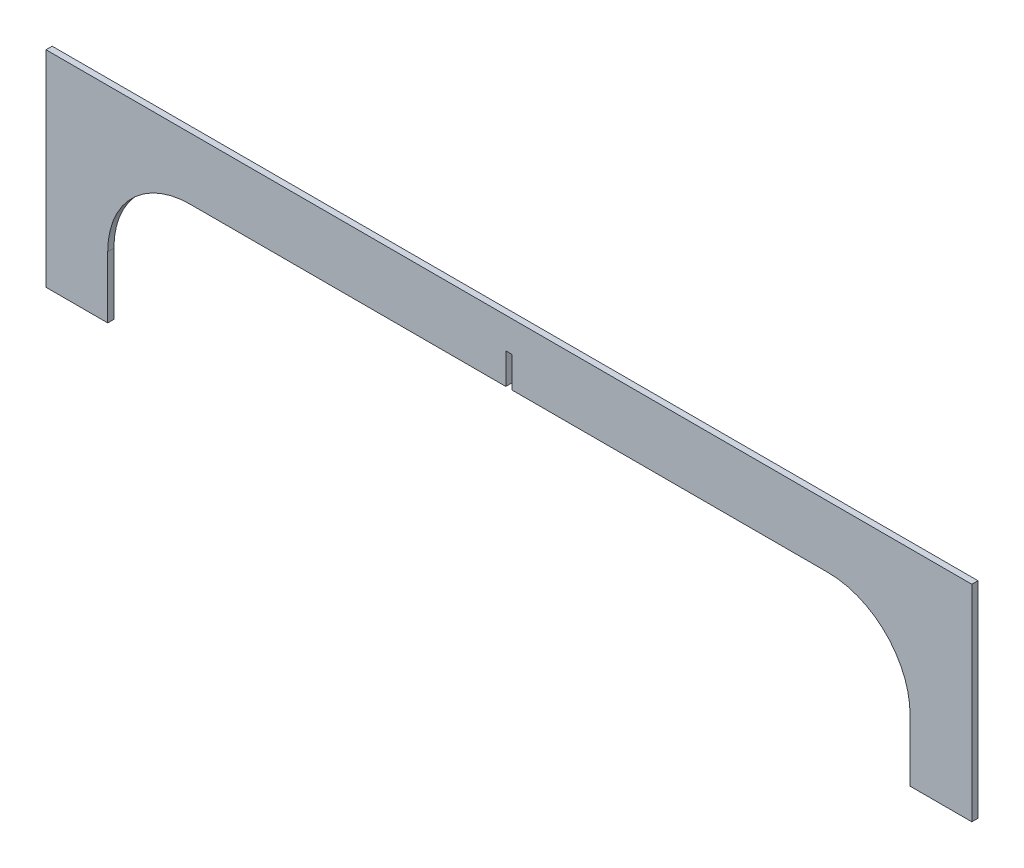
from build123d import *

# Parameters (mm, degrees)
BOSS_EXTRUDE1_DEPTH = 3
FILLET1_R           = 40


with BuildPart() as part:
    # Sketch1 → Boss-Extrude1 (new body)
    with BuildSketch(Plane.XY):
        Polygon((0, 0), (0, 100), (450, 100), (450, 0), (420, 0), (420, 70), (226.5, 70), (226.5, 85), (223.5, 85), (223.5, 70), (30, 70), (30, 0), align=None)
    extrude(amount=BOSS_EXTRUDE1_DEPTH)

    # Fillet1
    fillet1_edges = [part.edges().sort_by_distance(p)[0] for p in [
        (420, 70, 1.5),
        (30, 70, 1.5),
    ]]
    fillet(fillet1_edges, radius=FILLET1_R)


solid = part.part
